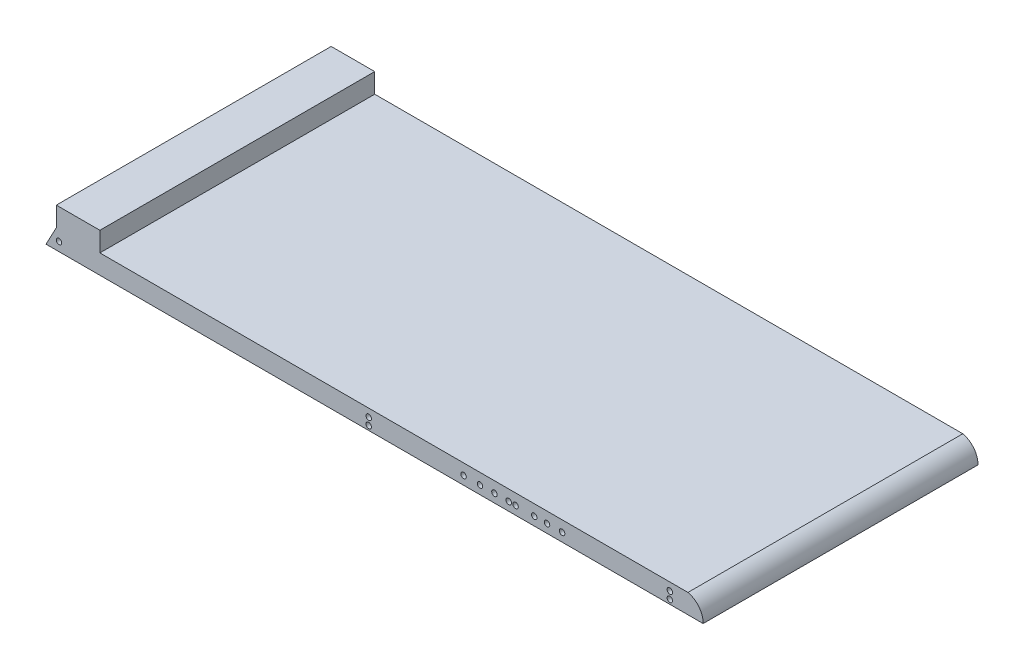
from build123d import *

# Parameters (mm, degrees)
BOSS_EXTRUDE1_DEPTH = 701
SKETCH3_R           = 7
CUT_EXTRUDE1_DEPTH  = 14
SKETCH4_R           = 7
CUT_EXTRUDE2_DEPTH  = 14
SKETCH5_R           = 7
CUT_EXTRUDE3_DEPTH  = 14
SKETCH6_R           = 7
BOSS_EXTRUDE2_DEPTH = 10
SKETCH7_R           = 7
CUT_EXTRUDE4_DEPTH  = 14
SKETCH8_R           = 7
CUT_EXTRUDE5_DEPTH  = 14
SKETCH9_R           = 7
CUT_EXTRUDE6_DEPTH  = 14
SKETCH10_R          = 7
CUT_EXTRUDE7_DEPTH  = 10
SKETCH11_W          = 111.127913471
SKETCH11_H          = 701
BOSS_EXTRUDE3_DEPTH = 50


with BuildPart() as part:
    # Sketch2 → Boss-Extrude1 (new body)
    with BuildSketch(Plane.XY):
        with BuildLine():
            Line((-838, 0), (838, 0))
            ThreePointArc((838, 0), (827.375455805, 31.557279357), (799.290407516, 49.4450652))
            Line((799.290407516, 49.4450652), (-811.709592484, 49.4450652))
            Line((-811.709592484, 49.4450652), (-838, 0))
        make_face()
    extrude(amount=BOSS_EXTRUDE1_DEPTH)

    # Sketch3 → Cut-Extrude1 (cut)
    with BuildSketch(Plane.XY.offset(701)):
        with Locations((753, 11.005388452)):
            Circle(SKETCH3_R)
        with Locations((753, 29.441497119)):
            Circle(SKETCH3_R)
        with Locations((-15, 29.441497119)):
            Circle(SKETCH3_R)
        with Locations((-15, 11.005388452)):
            Circle(SKETCH3_R)
    extrude(amount=-CUT_EXTRUDE1_DEPTH, mode=Mode.SUBTRACT)

    # Sketch4 → Cut-Extrude2 (cut)
    with BuildSketch(Plane(origin=(0, 0, 0), x_dir=(-1, 0, 0), z_dir=(0, 0, -1))):
        with Locations((-753, 11)):
            Circle(SKETCH4_R)
        with Locations((-753, 29.4)):
            Circle(SKETCH4_R)
        with Locations((15, 11)):
            Circle(SKETCH4_R)
        with Locations((15, 29.4)):
            Circle(SKETCH4_R)
    extrude(amount=-CUT_EXTRUDE2_DEPTH, mode=Mode.SUBTRACT)

    # Sketch5 → Cut-Extrude3 (cut)
    with BuildSketch(Plane(origin=(0, 0, 0), x_dir=(-1, 0, 0), z_dir=(0, 0, -1))):
        with Locations((-320.866149007, 24.947412588)):
            Circle(SKETCH5_R)
        with Locations((-278.502426445, 24.947412588)):
            Circle(SKETCH5_R)
    extrude(amount=-CUT_EXTRUDE3_DEPTH, mode=Mode.SUBTRACT)

    # Sketch6 → Boss-Extrude2 (add)
    with BuildSketch(Plane(origin=(0, 0, 0), x_dir=(-1, 0, 0), z_dir=(0, 0, -1))):
        with Locations(Location((804.854796242, 24.362661379, 0), (0, 0, 180))):
            Circle(SKETCH6_R)
    extrude(amount=BOSS_EXTRUDE2_DEPTH)

    # Sketch7 → Cut-Extrude4 (cut)
    with BuildSketch(Plane(origin=(0, 0, 0), x_dir=(-1, 0, 0), z_dir=(0, 0, -1))):
        with Locations((-365.57912829, 24.947412588)):
            Circle(SKETCH7_R)
        with Locations((-405.274636015, 24.947412588)):
            Circle(SKETCH7_R)
        with Locations((-458.742054583, 24.947412588)):
            Circle(SKETCH7_R)
        with Locations((-433.628570104, 24.947412588)):
            Circle(SKETCH7_R)
    extrude(amount=-CUT_EXTRUDE4_DEPTH, mode=Mode.SUBTRACT)

    # Sketch8 → Cut-Extrude5 (cut)
    with BuildSketch(Plane.XY.offset(701)):
        with Locations((226.886142598, 21.805746879)):
            Circle(SKETCH8_R)
        with Locations((268.91811361, 21.805746879)):
            Circle(SKETCH8_R)
        with Locations((305.755121912, 21.805746879)):
            Circle(SKETCH8_R)
        with Locations((342.119860878, 21.805746879)):
            Circle(SKETCH8_R)
        with Locations((407.293029413, 21.805746879)):
            Circle(SKETCH8_R)
        with Locations((439.819163205, 21.805746879)):
            Circle(SKETCH8_R)
        with Locations((478.174989696, 21.805746879)):
            Circle(SKETCH8_R)
    extrude(amount=-CUT_EXTRUDE5_DEPTH, mode=Mode.SUBTRACT)

    # Sketch9 → Cut-Extrude6 (cut)
    with BuildSketch(Plane.XY.offset(701)):
        with Locations((-804.854796242, 22.721056166)):
            Circle(SKETCH9_R)
    extrude(amount=-CUT_EXTRUDE6_DEPTH, mode=Mode.SUBTRACT)

    # Sketch10 → Cut-Extrude7 (cut)
    with BuildSketch(Plane.XY.offset(701)):
        with Locations((342.119860878, 21.805746879)):
            Circle(SKETCH10_R)
        with Locations((359.619860878, 21.805746879)):
            Circle(SKETCH10_R)
    extrude(amount=-CUT_EXTRUDE7_DEPTH, mode=Mode.SUBTRACT)

    # Sketch11 → Boss-Extrude3 (add)
    with BuildSketch(Plane(origin=(0, 49.4450652, 0), x_dir=(1, 0, 0), z_dir=(0, 1, 0))):
        with Locations((-756.145635749, -350.5)):
            Rectangle(SKETCH11_W, SKETCH11_H)
    extrude(amount=BOSS_EXTRUDE3_DEPTH)


solid = part.part
